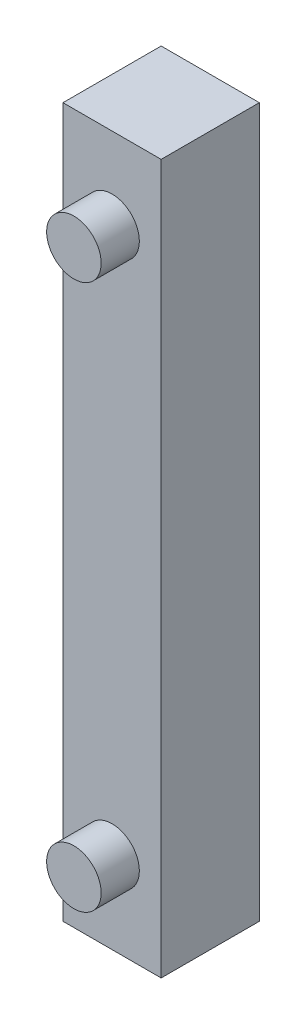
from build123d import *

# Parameters (mm, degrees)
SKETCH1_W           = 65
SKETCH1_H           = 9
BOSS_EXTRUDE1_DEPTH = 6.25
SKETCH2_W           = 9
SKETCH2_H           = 65
SKETCH2_R           = 2.5
CUT_EXTRUDE1_DEPTH  = 3.5


with BuildPart() as part:
    # Sketch1 → Boss-Extrude1 (new, symmetric)
    with BuildSketch(Plane(origin=(0, 0, 0), x_dir=(0, 1, 0), z_dir=(0, 0, 1))):
        Rectangle(SKETCH1_W, SKETCH1_H)
    extrude(amount=BOSS_EXTRUDE1_DEPTH, both=True)

    # Sketch2 → Cut-Extrude1 (cut)
    with BuildSketch(Plane.XY.offset(6.25)):
        Rectangle(SKETCH2_W, SKETCH2_H)
        with Locations((0, -25)):
            Circle(SKETCH2_R, mode=Mode.SUBTRACT)
        with Locations((0, 25)):
            Circle(SKETCH2_R, mode=Mode.SUBTRACT)
    extrude(amount=-CUT_EXTRUDE1_DEPTH, mode=Mode.SUBTRACT)


solid = part.part
